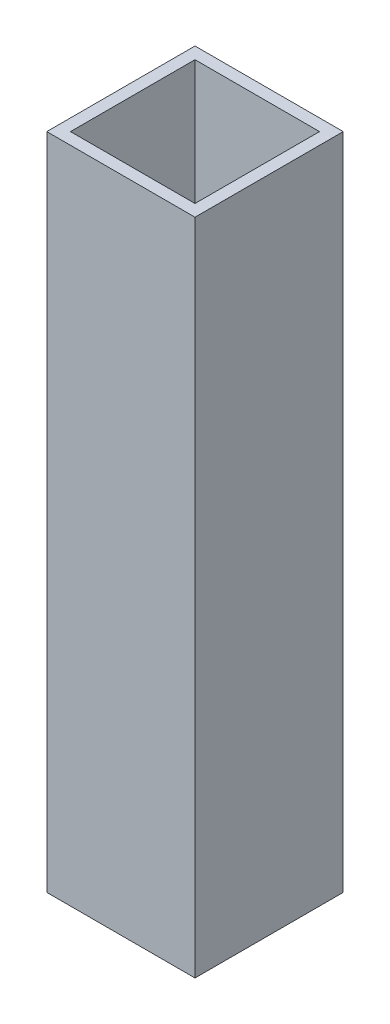
from build123d import *

# Parameters (mm, degrees)
SKETCH1_W           = 45
SKETCH1_H           = 45
SKETCH1_W_2         = 37.8
SKETCH1_H_2         = 37.8
BOSS_EXTRUDE1_DEPTH = 200


with BuildPart() as part:
    # Sketch1 → Boss-Extrude1 (new body)
    with BuildSketch(Plane(origin=(0, 0, 0), x_dir=(1, 0, 0), z_dir=(0, 1, 0))):
        Rectangle(SKETCH1_W, SKETCH1_H)
        Rectangle(SKETCH1_W_2, SKETCH1_H_2, mode=Mode.SUBTRACT)
    extrude(amount=-BOSS_EXTRUDE1_DEPTH)


solid = part.part
